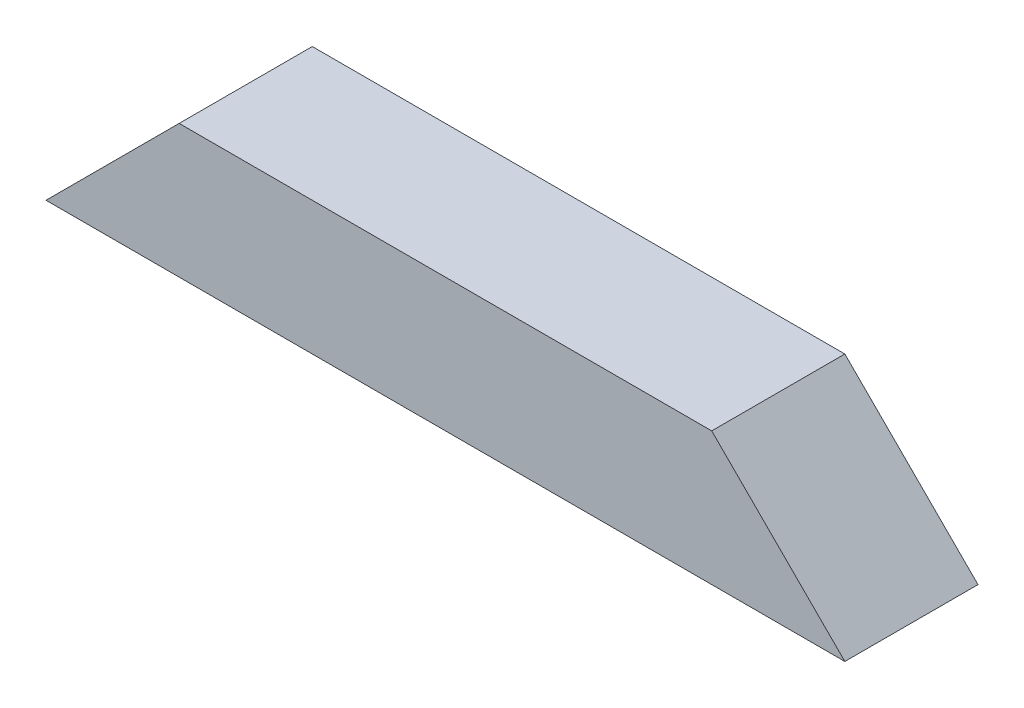
from build123d import *

# Parameters (mm, degrees)
CROQUIS1_W              = 304.8
CROQUIS1_H              = 50.8
SALIENTE_EXTRUIR1_DEPTH = 50.8
CORTAR_EXTRUIR1_DEPTH   = 163.639355631
CORTAR_EXTRUIR2_DEPTH   = 163.639355631


with BuildPart() as part:
    # Croquis1 → Saliente-Extruir1 (new body)
    with BuildSketch(Plane.XY):
        Rectangle(CROQUIS1_W, CROQUIS1_H)
    extrude(amount=SALIENTE_EXTRUIR1_DEPTH)

    # Croquis2 → Cortar-Extruir1 (cut, through all)
    with BuildSketch(Plane.XY.offset(50.8)):
        Polygon((-132.4, 25.4), (-152.4, 25.4), (-152.4, -25.4), align=None)
        Polygon((152.4, 25.4), (132.4, 25.4), (152.4, -25.4), align=None)
    extrude(amount=-CORTAR_EXTRUIR1_DEPTH, mode=Mode.SUBTRACT)

    # Croquis3 → Cortar-Extruir2 (cut, through all)
    with BuildSketch(Plane.XY.offset(50.8)):
        Polygon((-132.4, 25.4), (-152.4, -25.4), (-101.6, 25.4), align=None)
        Polygon((132.4, 25.4), (101.6, 25.4), (152.4, -25.4), align=None)
    extrude(amount=-CORTAR_EXTRUIR2_DEPTH, mode=Mode.SUBTRACT)


solid = part.part
